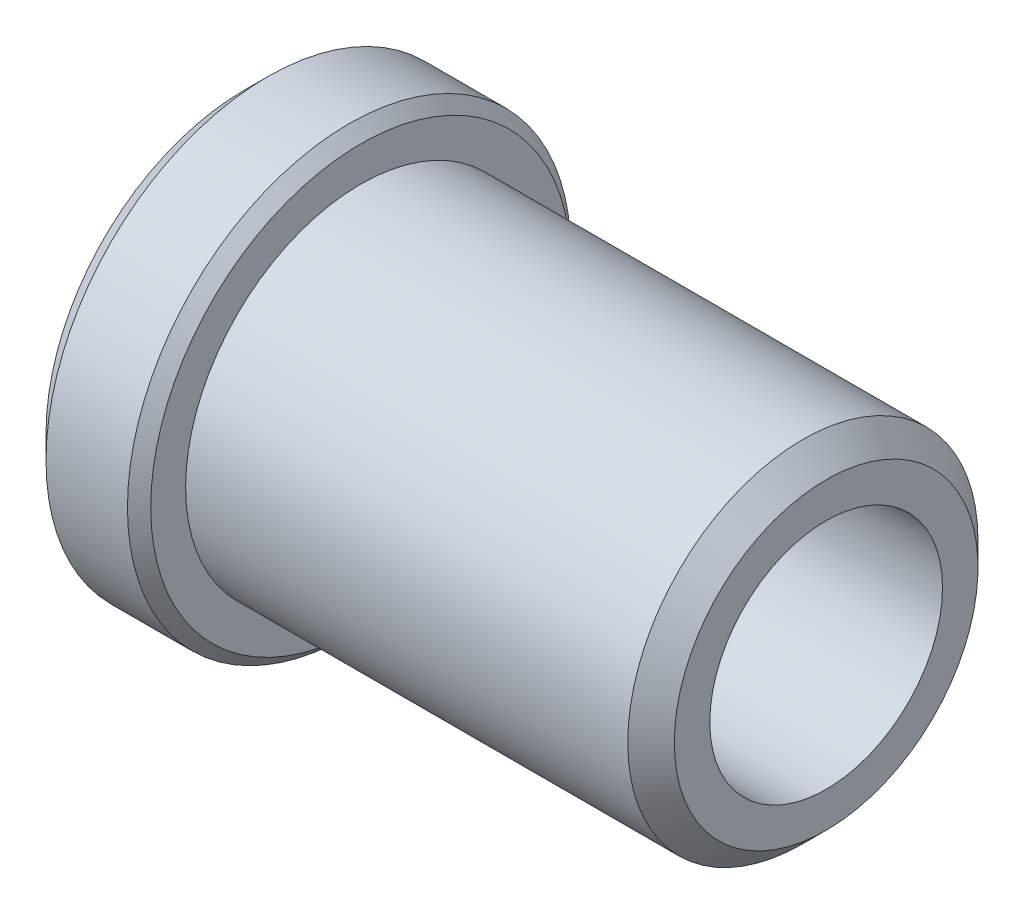
from build123d import *

# Parameters (mm, degrees)
CHAMFER1_SIZE                = 1
CHAMFER2_SIZE                = 0.5
M10_TAPPED_HOLE1_D           = 10
M10_TAPPED_HOLE1_CSINK_D     = 12
M10_TAPPED_HOLE1_CSINK_ANGLE = 90


with BuildPart() as part:
    # Sketch1 → Revolve1 (revolve)
    with BuildSketch(Plane.XY):
        Polygon((0, 9.525), (-5, 9.525), (-5, 0), (20, 0), (20, 7.525), (0, 7.525), align=None)
    revolve(axis=Axis((-15.231671031, 0, 0), (1, 0, 0)))

    # Chamfer1
    chamfer1_edges = [part.edges().sort_by_distance(p)[0] for p in [
        (-5, -9.525, 0),
        (20, -7.525, 0),
    ]]
    chamfer(chamfer1_edges, length=CHAMFER1_SIZE)

    # Chamfer2
    chamfer2_edges = [part.edges().sort_by_distance(p)[0] for p in [
        (0, -9.525, 0),
    ]]
    chamfer(chamfer2_edges, length=CHAMFER2_SIZE)

    # M10 Tapped Hole1 (through all)
    with Locations(Plane.ZY.offset(5)):
        with Locations((0, 0)):
            CounterSinkHole(M10_TAPPED_HOLE1_D / 2, M10_TAPPED_HOLE1_CSINK_D / 2, counter_sink_angle=M10_TAPPED_HOLE1_CSINK_ANGLE)


solid = part.part
